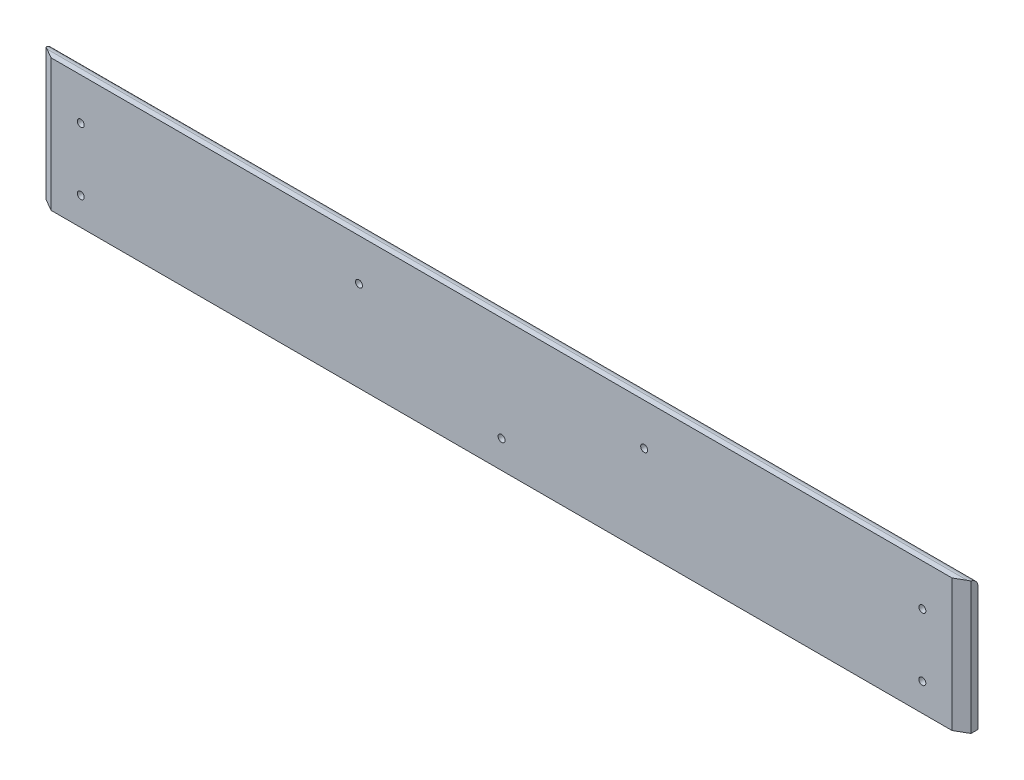
from build123d import *
from OCP.BRepFilletAPI import BRepFilletAPI_MakeChamfer

# Parameters (mm, degrees)
SKETCH_1_W          = 665
SKETCH_1_H          = 95
EXTRUDE_1_DEPTH     = 5
FILLET_1_R          = 6
CHAMFER_1_SIZE      = 5
CHAMFER_1_SIZE2     = 8.660254038
SKETCH_3_R          = 2.5
CUT_EXTRUDE_1_DEPTH = 337.024552674
CHAMFER_2_SIZE      = 2


with BuildPart() as part:
    # Эскиз1 → Бобышка-Вытянуть1 (new, symmetric)
    with BuildSketch(Plane.XY):
        Rectangle(SKETCH_1_W, SKETCH_1_H)
    extrude(amount=EXTRUDE_1_DEPTH, both=True)

    # Скругление1
    fillet_1_edges = [part.edges().sort_by_distance(p)[0] for p in [
        (0, 47.5, -5),
    ]]
    fillet(fillet_1_edges, radius=FILLET_1_R)

    # Фаска1: one chamfer whose edges measure the first distance from different faces: ONE call of the kernel's chamfer builder (chamfer() names one face for all edges)
    chamfer_1_edges_1 = [part.edges().sort_by_distance(p)[0] for p in [
        (332.5, 0, 5),
    ]]
    chamfer_1_side_1 = [part.faces().sort_by_distance(p)[0] for p in [
        (332.5, -0.378462122, 0.030006478),
    ]]
    chamfer_1_edges_2 = [part.edges().sort_by_distance(p)[0] for p in [
        (-332.5, 0, 5),
    ]]
    chamfer_1_side_2 = [part.faces().sort_by_distance(p)[0] for p in [
        (-332.5, -0.378462122, 0.030006478),
    ]]
    chamfer_1 = BRepFilletAPI_MakeChamfer(part.part.solid().wrapped)
    for e in chamfer_1_edges_1:
        chamfer_1.Add(CHAMFER_1_SIZE, CHAMFER_1_SIZE2, e.wrapped, chamfer_1_side_1[0].wrapped)  # the first distance lies on this face
    for e in chamfer_1_edges_2:
        chamfer_1.Add(CHAMFER_1_SIZE, CHAMFER_1_SIZE2, e.wrapped, chamfer_1_side_2[0].wrapped)  # the first distance lies on this face
    add(Compound.cast(chamfer_1.Shape()), mode=Mode.REPLACE)

    # Эскиз3 → Вырез-Вытянуть1 (cut, through all)
    with BuildSketch(Plane.XY.offset(5)):
        with Locations((-302.5, -27.5)):
            Circle(SKETCH_3_R)
        with Locations((0, -27.5)):
            Circle(SKETCH_3_R)
        with Locations((302.5, -27.5)):
            Circle(SKETCH_3_R)
        with Locations((-302.5, 17.5)):
            Circle(SKETCH_3_R)
        with Locations((302.5, 17.5)):
            Circle(SKETCH_3_R)
        with Locations((-102.5, 17.5)):
            Circle(SKETCH_3_R)
        with Locations((102.5, 17.5)):
            Circle(SKETCH_3_R)
    extrude(amount=-CUT_EXTRUDE_1_DEPTH, mode=Mode.SUBTRACT)

    # Фаска2
    chamfer_2_edges = [part.edges().sort_by_distance(p)[0] for p in [
        (-2.5, -27.5, -5),
        (300, -27.5, -5),
        (-305, 17.5, -5),
        (300, 17.5, -5),
        (-105, 17.5, -5),
        (100, 17.5, -5),
        (-305, -27.5, -5),
    ]]
    chamfer(chamfer_2_edges, length=CHAMFER_2_SIZE)


solid = part.part
